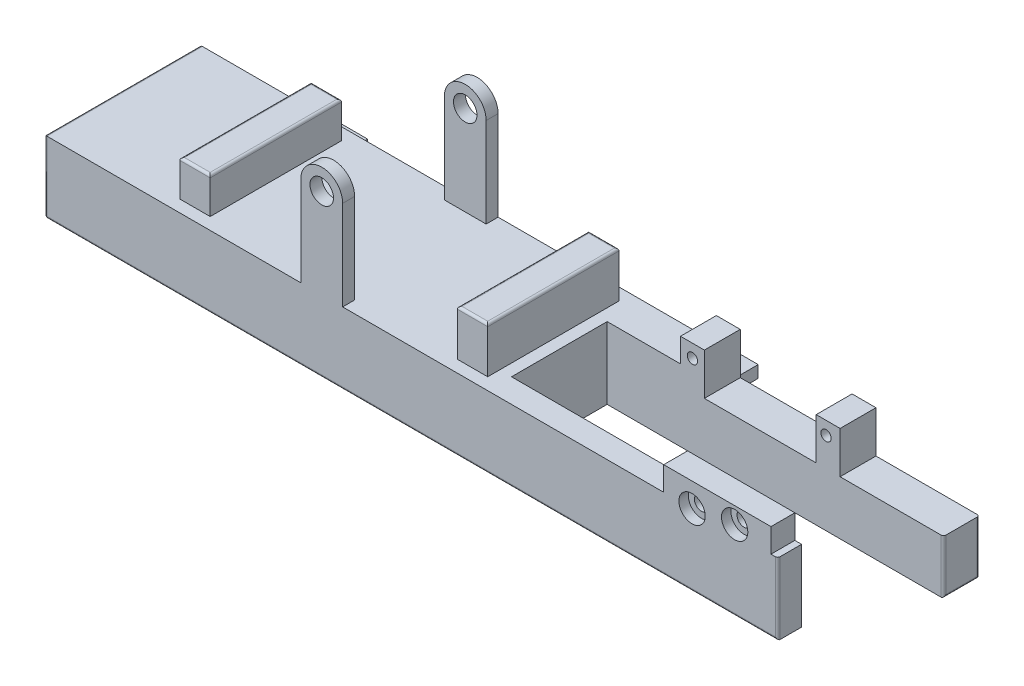
from build123d import *

# Parameters (mm, degrees)
BOSS_EXTRUDE1_DEPTH     = 15.24
SKETCH3_R               = 2.5
BOSS_EXTRUDE2_DEPTH     = 2.54
SKETCH4_W               = 6.457620629
SKETCH4_H               = 27.913585942
BOSS_EXTRUDE3_DEPTH     = 7.62
SKETCH11_W              = 6.457620629
SKETCH11_H              = 27.913585942
BOSS_EXTRUDE6_DEPTH     = 2.0955
CUT_EXTRUDE1_DEPTH      = 111.34392643
CUT_EXTRUDE1_DEPTH_BACK = 3.332
SKETCH6_R               = 2.15
FILLET1_R               = 0.508
SKETCH8_W               = 21.59
SKETCH8_H               = 20.32
CUT_EXTRUDE2_DEPTH      = 111.477226273
SKETCH1_3_W             = 10
SKETCH1_3_H             = 13.208
SKETCH1_3_R             = 2
BOSS_EXTRUDE5_DEPTH     = 2.54
CUT_EXTRUDE5_DEPTH      = 9.2075
CUT_EXTRUDE5_DEPTH_BACK = 117.302117887
SKETCH14_W              = 50.8
SKETCH14_H              = 3.81
BOSS_EXTRUDE7_START     = -7.62
SKETCH15_W              = 5.08
SKETCH15_H              = 5.08
SKETCH15_H_2            = 8.89
BOSS_EXTRUDE7_DEPTH     = 7.62
CUT_EXTRUDE6_REACH      = 118.302
SKETCH16_R              = 1.0922
SKETCH18_W              = 22.782868823
SKETCH18_H              = 5.08
BOSS_EXTRUDE8_DEPTH     = 5.08
CUT_EXTRUDE3_DEPTH      = 12.7
CUT_EXTRUDE3_DEPTH_BACK = 12.7
SKETCH9_R               = 1.4986
SKETCH10_R              = 2.794
CUT_EXTRUDE4_DEPTH      = 2
SKETCH20_R              = 2.15
BOSS_EXTRUDE9_DEPTH     = 1
BOSS_EXTRUDE10_START    = -1
SKETCH21_R              = 2.15
BOSS_EXTRUDE10_DEPTH    = 1


with BuildPart() as part:
    # Sketch1 → Boss-Extrude1 (new body)
    with BuildSketch(Plane(origin=(0, 0, 0), x_dir=(1, 0, 0), z_dir=(0, 1, 0))):
        Polygon((-58.867621619, 16.51), (-58.867621619, -16.51), (96.852680324, -16.51), (96.852680324, -11.43), (55.88, -11.43), (55.88, 8.89), (106.68, 8.89), (106.68, 16.51), align=None)
    extrude(amount=BOSS_EXTRUDE1_DEPTH)

    # Sketch3 → Boss-Extrude2 (add)
    with BuildSketch(Plane.XY.offset(16.51)):
        with BuildLine():
            Line((4.445, 15.24), (-4.445, 15.24))
            Line((-4.445, 15.24), (-4.445, 34.29))
            ThreePointArc((-4.445, 34.29), (0, 38.735), (4.445, 34.29))
            Line((4.445, 34.29), (4.445, 15.24))
        make_face()
        with Locations((0, 34.29)):
            Circle(SKETCH3_R, mode=Mode.SUBTRACT)
    boss_extrude2 = extrude(amount=-BOSS_EXTRUDE2_DEPTH)

    # Mirror1: Boss-Extrude2 across plane
    add(boss_extrude2.mirror(Plane.XY))

    # Sketch4 → Boss-Extrude3 (add)
    with BuildSketch(Plane(origin=(0, 15.24, 0), x_dir=(1, 0, 0), z_dir=(0, 1, 0))):
        with Locations((29.475913514, 0)):
            Rectangle(SKETCH4_W, SKETCH4_H)
        with Locations((-29.475913514, 0)):
            Rectangle(SKETCH4_W, SKETCH4_H)
    extrude(amount=BOSS_EXTRUDE3_DEPTH)

    # Sketch11 → Boss-Extrude6 (add)
    with BuildSketch(Plane(origin=(0, 22.86, 0), x_dir=(1, 0, 0), z_dir=(0, 1, 0))):
        with Locations((29.475913514, 0)):
            Rectangle(SKETCH11_W, SKETCH11_H)
    extrude(amount=BOSS_EXTRUDE6_DEPTH)

    # Sketch6 → Cut-Extrude1 (cut, two sides: drawn at the far end of the back side and taken through both)
    with BuildSketch(Plane(origin=(0, 22.86, 0), x_dir=(1, 0, 0), z_dir=(0, 1, 0)).offset(-CUT_EXTRUDE1_DEPTH_BACK)):
        with Locations(Location((29.5986053, 8.550450758, 0), (0, 0, 270))):
            Circle(SKETCH6_R)
        with Locations(Location((29.5986053, -8.550450758, 0), (0, 0, 270))):
            Circle(SKETCH6_R)
        with Locations(Location((-29.5986053, -8.550450758, 0), (0, 0, 90))):
            Circle(SKETCH6_R)
        with Locations(Location((-29.5986053, 8.550450758, 0), (0, 0, 90))):
            Circle(SKETCH6_R)
    extrude(amount=CUT_EXTRUDE1_DEPTH + CUT_EXTRUDE1_DEPTH_BACK, mode=Mode.SUBTRACT)

    # Fillet1
    fillet1_edges = [part.edges().sort_by_distance(p)[0] for p in [
        (-58.867621619, 0, 0),
        (106.68, 0, -12.7),
        (18.992529352, 0, 16.51),
        (-58.867621619, 7.62, 16.51),
        (-58.867621619, 7.62, -16.51),
        (106.68, 7.62, -16.51),
        (106.68, 7.62, -8.89),
        (96.852680324, 7.62, 16.51),
        (106.68, 15.24, -12.7),
        (-58.867621619, 15.24, 0),
        (-26.247103199, 22.86, 0),
        (-29.475913514, 22.86, -13.956792971),
        (-32.704723828, 22.86, 0),
        (-29.475913514, 22.86, 13.956792971),
        (32.704723828, 24.9555, 0),
        (29.475913514, 24.9555, -13.956792971),
        (26.247103199, 24.9555, 0),
        (29.475913514, 24.9555, 13.956792971),
    ]]
    fillet(fillet1_edges, radius=FILLET1_R)

    # Sketch8 → Cut-Extrude2 (cut, through all)
    with BuildSketch(Plane(origin=(0, 15.24, 0), x_dir=(1, 0, 0), z_dir=(0, 1, 0))):
        with Locations((46.028773367, -1.27)):
            Rectangle(SKETCH8_W, SKETCH8_H)
    extrude(amount=-CUT_EXTRUDE2_DEPTH, mode=Mode.SUBTRACT)

    # Sketch1<3> → Boss-Extrude5 (add)
    # profile 1 of 2: a face of its own
    with BuildSketch(Plane(origin=(0, 0, 0), x_dir=(1, 0, 0), z_dir=(0, 1, 0))):
        with Locations((-41.488351659, 23.114)):
            Rectangle(SKETCH1_3_W, SKETCH1_3_H)
        with Locations(Location((-41.488351659, 20.01, 0), (0, 0, 270))):
            Circle(SKETCH1_3_R, mode=Mode.SUBTRACT)
    # profile 2 of 2: a face of its own
    with BuildSketch(Plane(origin=(0, 0, 0), x_dir=(1, 0, 0), z_dir=(0, 1, 0))):
        with Locations((41.488351659, 23.114)):
            Rectangle(SKETCH1_3_W, SKETCH1_3_H)
        with Locations(Location((41.488351659, 20.01, 0), (0, 0, 270))):
            Circle(SKETCH1_3_R, mode=Mode.SUBTRACT)
    extrude(amount=BOSS_EXTRUDE5_DEPTH)

    # Sketch14 → Cut-Extrude5 (cut, two sides: drawn at the far end of the back side and taken through both)
    with BuildSketch(Plane.XY.offset(-8.89).offset(-CUT_EXTRUDE5_DEPTH_BACK)):
        with Locations((81.28, 13.335)):
            Rectangle(SKETCH14_W, SKETCH14_H)
    extrude(amount=CUT_EXTRUDE5_DEPTH + CUT_EXTRUDE5_DEPTH_BACK, mode=Mode.SUBTRACT)

    # Sketch15 → Boss-Extrude7 (add)
    with BuildSketch(Plane.XY.offset(-8.89).offset(BOSS_EXTRUDE7_START)):
        with Locations((53.34, 17.78)):
            Rectangle(SKETCH15_W, SKETCH15_H)
        with Locations((82.169, 15.875)):
            Rectangle(SKETCH15_W, SKETCH15_H_2)
    extrude(amount=BOSS_EXTRUDE7_DEPTH)

    # Sketch16 → Cut-Extrude6 (cut, up to next)
    with BuildSketch(Plane.XY.offset(-8.89), mode=Mode.PRIVATE) as cut_extrude6_sk1:
        with Locations((53.34, 17.526)):
            Circle(SKETCH16_R)
    cut_extrude6_tool1 = extrude(cut_extrude6_sk1.sketch, amount=-CUT_EXTRUDE6_REACH, mode=Mode.PRIVATE) & part.part
    # Sketch16 → Cut-Extrude6 (cut, up to next)
    with BuildSketch(Plane.XY.offset(-8.89), mode=Mode.PRIVATE) as cut_extrude6_sk2:
        with Locations((81.7245, 17.526)):
            Circle(SKETCH16_R)
    cut_extrude6_tool2 = extrude(cut_extrude6_sk2.sketch, amount=-CUT_EXTRUDE6_REACH, mode=Mode.PRIVATE) & part.part
    add(cut_extrude6_tool1.solids().sort_by_distance((53.34, 17.526, -8.89))[0], mode=Mode.SUBTRACT)
    add(cut_extrude6_tool2.solids().sort_by_distance((81.7245, 17.526, -8.89))[0], mode=Mode.SUBTRACT)

    # Sketch18 → Boss-Extrude8 (add)
    with BuildSketch(Plane(origin=(0, 15.24, 0), x_dir=(1, 0, 0), z_dir=(0, 1, 0))):
        with Locations((84.032315508, -13.97)):
            Rectangle(SKETCH18_W, SKETCH18_H)
    extrude(amount=BOSS_EXTRUDE8_DEPTH)

    # Sketch9 → Cut-Extrude3 (cut, two sides: drawn at the far end of the back side and taken through both)
    with BuildSketch(Plane(origin=(0, 0, 11.43), x_dir=(-1, 0, 0), z_dir=(0, 0, -1)).offset(-CUT_EXTRUDE3_DEPTH_BACK)):
        with Locations((-87.713434176, 16.836660264)):
            Circle(SKETCH9_R)
        with Locations((-78.658323849, 15.24)):
            Circle(SKETCH9_R)
    extrude(amount=CUT_EXTRUDE3_DEPTH + CUT_EXTRUDE3_DEPTH_BACK, mode=Mode.SUBTRACT)

    # Sketch10 → Cut-Extrude4 (cut)
    with BuildSketch(Plane.XY.offset(16.51)):
        with Locations((78.658323849, 15.24)):
            Circle(SKETCH10_R)
        with Locations((87.713434176, 16.836660264)):
            Circle(SKETCH10_R)
    extrude(amount=-CUT_EXTRUDE4_DEPTH, mode=Mode.SUBTRACT)

    # Sketch20 → Boss-Extrude9 (add)
    with BuildSketch(Plane(origin=(0, 22.86, 0), x_dir=(1, 0, 0), z_dir=(0, 1, 0))):
        with Locations(Location((-29.5986053, -8.550450758, 0), (0, 0, 270))):
            Circle(SKETCH20_R)
        with Locations(Location((-29.5986053, 8.550450758, 0), (0, 0, 270))):
            Circle(SKETCH20_R)
    extrude(amount=-BOSS_EXTRUDE9_DEPTH)

    # Sketch21 → Boss-Extrude10 (add)
    with BuildSketch(Plane(origin=(0, 24.9555, 0), x_dir=(1, 0, 0), z_dir=(0, 1, 0)).offset(BOSS_EXTRUDE10_START)):
        with Locations(Location((29.5986053, -8.550450758, 0), (0, 0, 270))):
            Circle(SKETCH21_R)
        with Locations(Location((29.5986053, 8.550450758, 0), (0, 0, 270))):
            Circle(SKETCH21_R)
    extrude(amount=BOSS_EXTRUDE10_DEPTH)


solid = part.part
